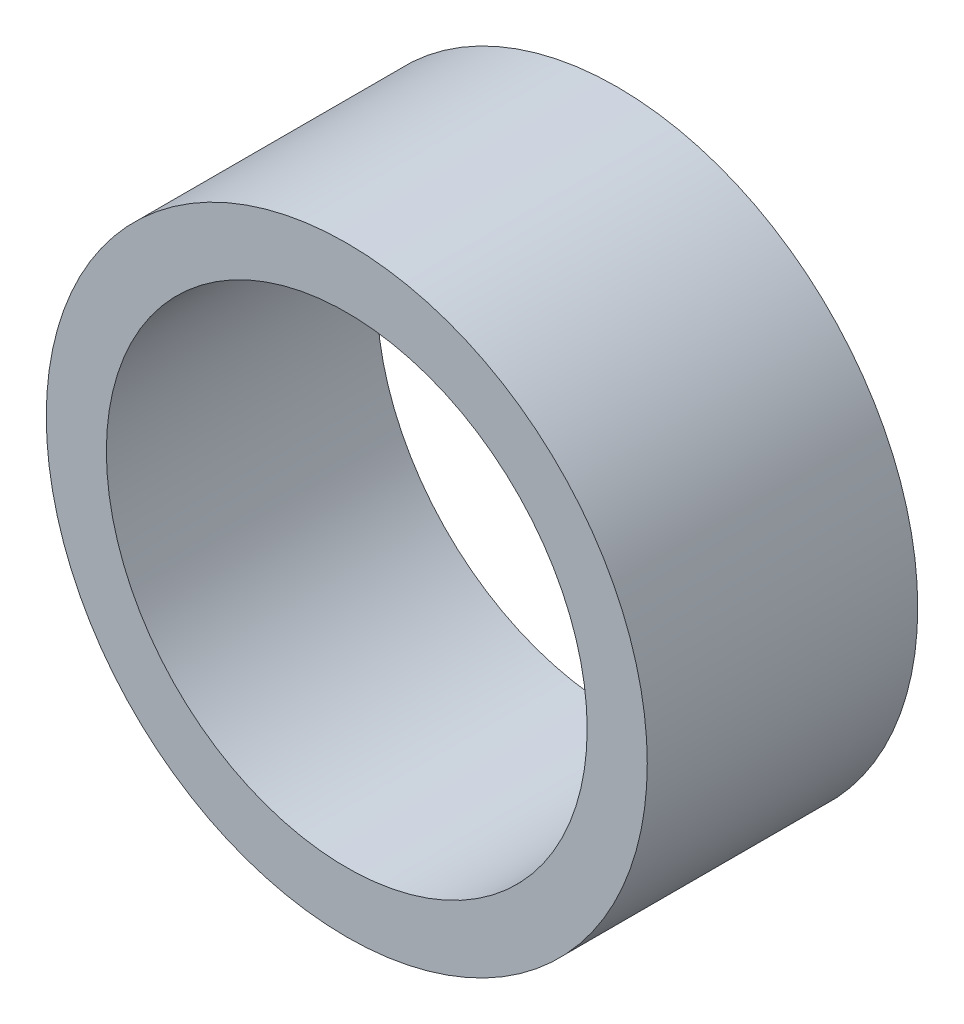
from build123d import *

# Parameters (mm, degrees)
SKETCH1_R           = 12.7
BOSS_EXTRUDE1_DEPTH = 11.43
SKETCH2_R           = 10.16
CUT_EXTRUDE1_DEPTH  = 22.28907936


with BuildPart() as part:
    # Sketch1 → Boss-Extrude1 (new body)
    with BuildSketch(Plane.XY):
        Circle(SKETCH1_R)
    extrude(amount=BOSS_EXTRUDE1_DEPTH)

    # Sketch2 → Cut-Extrude1 (cut, through all)
    with BuildSketch(Plane.XY.offset(11.43)):
        Circle(SKETCH2_R)
    extrude(amount=-CUT_EXTRUDE1_DEPTH, mode=Mode.SUBTRACT)


solid = part.part
